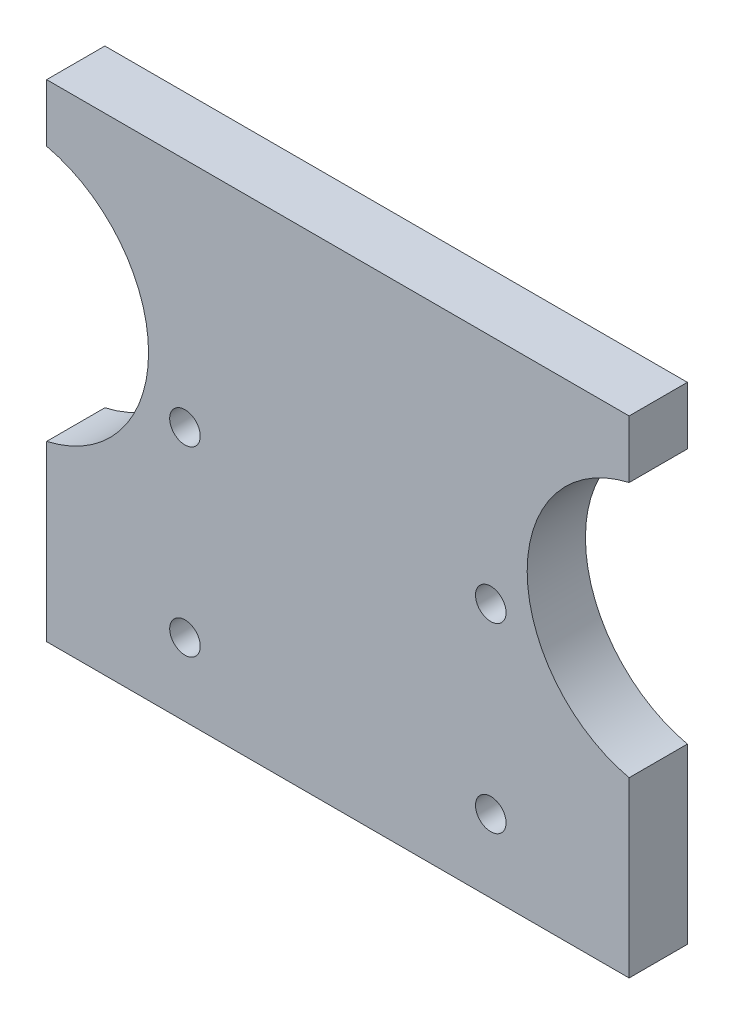
from build123d import *

# Parameters (mm, degrees)
SKETCH1_W           = 40
SKETCH1_H           = 33.426210179
BOSS_EXTRUDE1_DEPTH = 4
SKETCH2_R           = 1.05
CUT_EXTRUDE1_DEPTH  = 28.486819051
SKETCH3_R           = 9
CUT_EXTRUDE2_DEPTH  = 5


with BuildPart() as part:
    # Sketch1 → Boss-Extrude1 (new body)
    with BuildSketch(Plane.XY):
        with Locations((0, 1.713105089)):
            Rectangle(SKETCH1_W, SKETCH1_H)
    extrude(amount=BOSS_EXTRUDE1_DEPTH)

    # Sketch2 → Cut-Extrude1 (cut, through all)
    with BuildSketch(Plane(origin=(0, 0, 0), x_dir=(-1, 0, 0), z_dir=(0, 0, -1))):
        with Locations((-10.5, 2.5)):
            Circle(SKETCH2_R)
        with Locations((10.5, 2.5)):
            Circle(SKETCH2_R)
        with Locations((-10.5, -10)):
            Circle(SKETCH2_R)
        with Locations((10.5, -10)):
            Circle(SKETCH2_R)
    extrude(amount=-CUT_EXTRUDE1_DEPTH, mode=Mode.SUBTRACT)

    # Sketch3 → Cut-Extrude2 (cut)
    with BuildSketch(Plane.XY.offset(4)):
        with Locations((22, 5.687428233)):
            Circle(SKETCH3_R)
        with Locations((-22, 5.687428233)):
            Circle(SKETCH3_R)
    extrude(amount=-CUT_EXTRUDE2_DEPTH, mode=Mode.SUBTRACT)


solid = part.part
